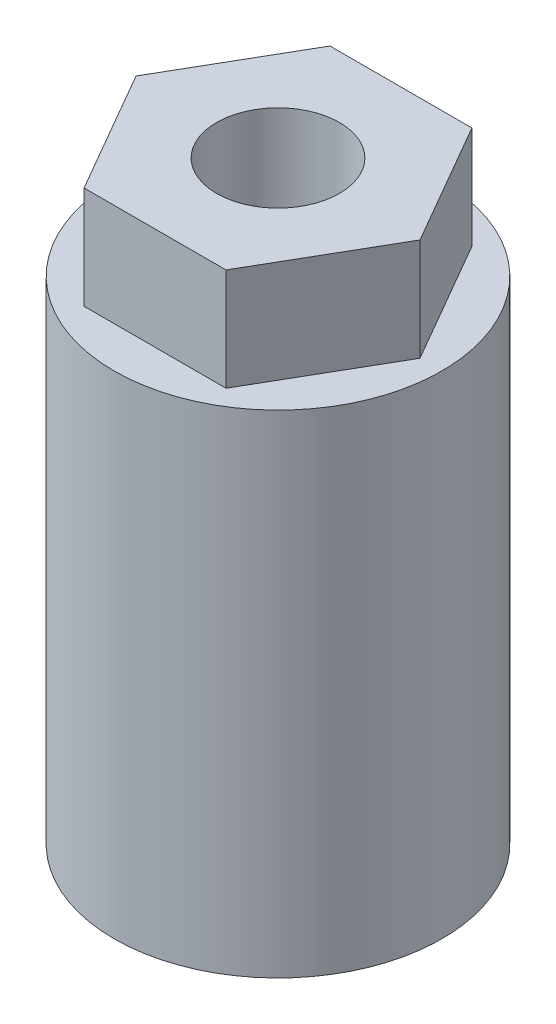
from build123d import *

# Parameters (mm, degrees)
SKETCH1_W                 = 3.7
SKETCH1_H                 = 12
SKETCH1_W_2               = 8
BOSS_EXTRUDE1_DEPTH       = 5
F_6_0MM_DOWEL_HOLE1_D     = 6
F_6_0MM_DOWEL_HOLE1_DEPTH = 10
F_6_0MM_DOWEL_HOLE1_TIP   = 1.802581857
CUT_EXTRUDE1_START        = -12
SKETCH5_W                 = 3.5
SKETCH5_H                 = 3.5
CUT_EXTRUDE1_DEPTH        = 12


with BuildPart() as part:
    # Sketch1 → Revolve1 (revolve)
    with BuildSketch(Plane.XY, mode=Mode.PRIVATE) as revolve1_sk:
        with Locations((6.15, 6)):
            Rectangle(SKETCH1_W, SKETCH1_H)
        with Locations((4, 18)):
            Rectangle(SKETCH1_W_2, SKETCH1_H)
    revolve(revolve1_sk.sketch.rotate(Axis((0, 0, 0), (0, 1, 0)), 90), axis=Axis((0, 0, 0), (0, 1, 0)))

    # Sketch2 → Boss-Extrude1 (add)
    with BuildSketch(Plane(origin=(0, 24, 0), x_dir=(1, 0, 0), z_dir=(0, 1, 0))):
        Polygon((6.92820323, 0), (3.464101615, 6), (-3.464101615, 6), (-6.92820323, 0), (-3.464101615, -6), (3.464101615, -6), align=None)
    extrude(amount=BOSS_EXTRUDE1_DEPTH)

    # Ø6.0mm Dowel Hole1
    with Locations(Plane(origin=(0, 29, 0), x_dir=(1, 0, 0), z_dir=(0, 1, 0))):
        with Locations((0, 0)):
            Hole(F_6_0MM_DOWEL_HOLE1_D / 2, depth=F_6_0MM_DOWEL_HOLE1_DEPTH)
            with Locations((0, 0, -(F_6_0MM_DOWEL_HOLE1_DEPTH + F_6_0MM_DOWEL_HOLE1_TIP / 2))):  # 118° drill point
                Cone(0, F_6_0MM_DOWEL_HOLE1_D / 2, F_6_0MM_DOWEL_HOLE1_TIP, mode=Mode.SUBTRACT)

    # Sketch5 → Cut-Extrude1 (cut)
    with BuildSketch(Plane.XZ.offset(CUT_EXTRUDE1_START)):
        with Locations((4.3, 0)):
            Rectangle(SKETCH5_W, SKETCH5_H)
    extrude(amount=CUT_EXTRUDE1_DEPTH, mode=Mode.SUBTRACT)


solid = part.part
